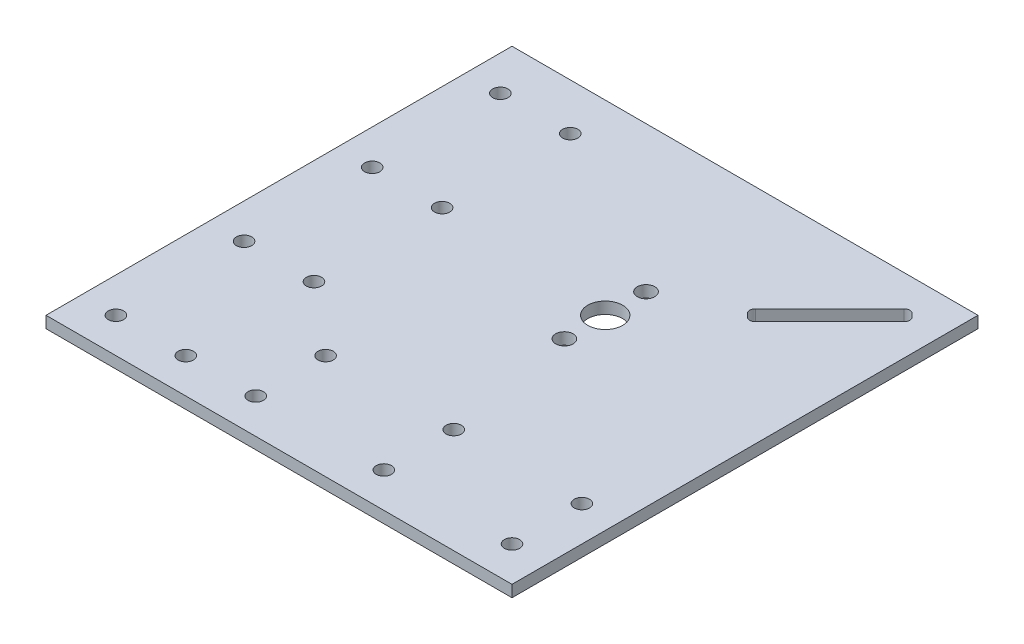
from build123d import *

# Parameters (mm, degrees)
SKETCH1_W                        = 254
SKETCH1_H                        = 254
BOSS_EXTRUDE1_DEPTH              = 6.35
F_3_4_0_75_DIAMETER_HOLE1_D      = 19.05
F_3_8_0_375_DIAMETER_HOLE1_D     = 9.525
F_21_64_0_32813_DIAMETER_HOLE1_D = 8.334502
LPATTERN1_COUNT                  = 2
LPATTERN1_PITCH                  = 38.1
LPATTERN1_COUNT_DIR2             = 4
LPATTERN1_PITCH_DIR2             = 69.85
F_21_64_0_32813_DIAMETER_HOLE2_D = 8.334502
LPATTERN2_COUNT                  = 2
LPATTERN2_PITCH                  = 38.1
LPATTERN2_COUNT_DIR2             = 3
LPATTERN2_PITCH_DIR2             = 69.85
CUT_EXTRUDE1_DEPTH               = 360.266367059
FILLET1_R                        = 3.175


with BuildPart() as part:
    # Sketch1 → Boss-Extrude1 (new body)
    with BuildSketch(Plane(origin=(0, 0, 0), x_dir=(1, 0, 0), z_dir=(0, 1, 0))):
        with Locations((127, 127)):
            Rectangle(SKETCH1_W, SKETCH1_H)
    extrude(amount=BOSS_EXTRUDE1_DEPTH)

    # 3/4 (0.75) Diameter Hole1 (through all)
    with Locations(Plane(origin=(0, 6.35, 0), x_dir=(1, 0, 0), z_dir=(0, 1, 0))):
        with Locations((152.4, 152.4)):
            Hole(F_3_4_0_75_DIAMETER_HOLE1_D / 2)

    # 3/8 (0.375) Diameter Hole1 (through all)
    with Locations(Plane(origin=(0, 6.35, 0), x_dir=(1, 0, 0), z_dir=(0, 1, 0))):
        with Locations((152.4, 174.6504), (152.4, 130.1496)):
            Hole(F_3_8_0_375_DIAMETER_HOLE1_D / 2)

    # 21/64 (0.32813) Diameter Hole1 (through all)
    with Locations(Plane(origin=(0, 6.35, 0), x_dir=(1, 0, 0), z_dir=(0, 1, 0))):
        with Locations((19.05, 19.05)):
            f_21_64_0_32813_diameter_hole1 = Hole(F_21_64_0_32813_DIAMETER_HOLE1_D / 2)

    # LPattern1: 21_64 _0.32813_ Diameter Hole1 2 × 4
    with Locations(*[(i * LPATTERN1_PITCH, 0, -j * LPATTERN1_PITCH_DIR2) for i in range(LPATTERN1_COUNT) for j in range(LPATTERN1_COUNT_DIR2) if (i, j) != (0, 0)]):
        add(f_21_64_0_32813_diameter_hole1, mode=Mode.SUBTRACT)

    # 21/64 (0.32813) Diameter Hole2 (through all)
    with Locations(Plane(origin=(0, 6.35, 0), x_dir=(1, 0, 0), z_dir=(0, 1, 0))):
        with Locations((234.95, 19.05)):
            f_21_64_0_32813_diameter_hole2 = Hole(F_21_64_0_32813_DIAMETER_HOLE2_D / 2)

    # LPattern2: 21_64 _0.32813_ Diameter Hole2 2 × 3
    with Locations(*[(-j * LPATTERN2_PITCH_DIR2, 0, -i * LPATTERN2_PITCH) for i in range(LPATTERN2_COUNT) for j in range(LPATTERN2_COUNT_DIR2) if (i, j) != (0, 0)]):
        add(f_21_64_0_32813_diameter_hole2, mode=Mode.SUBTRACT)

    # Sketch10 → Cut-Extrude1 (cut, through all)
    with BuildSketch(Plane(origin=(0, 6.35, 0), x_dir=(1, 0, 0), z_dir=(0, 1, 0))):
        Polygon((188.084920071, 194.191494234), (232.986200677, 239.092774839), (239.092774839, 232.986200677), (194.191494234, 188.084920071), align=None)
    extrude(amount=-CUT_EXTRUDE1_DEPTH, mode=Mode.SUBTRACT)

    # Fillet1
    fillet1_edges = [part.edges().sort_by_distance(p)[0] for p in [
        (194.191494234, 3.175, -188.084920071),
        (188.084920071, 3.175, -194.191494234),
        (232.986200677, 3.175, -239.092774839),
        (239.092774839, 3.175, -232.986200677),
    ]]
    fillet(fillet1_edges, radius=FILLET1_R)


solid = part.part
